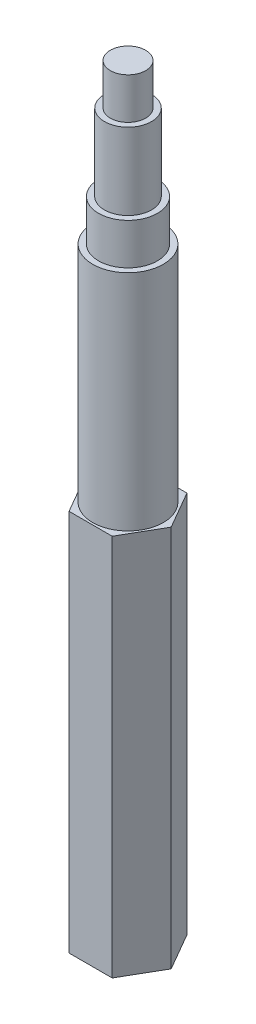
from build123d import *

# Parameters (mm, degrees)
SALIENTE_EXTRUIR1_DEPTH = 130
CROQUIS3_R              = 7.332348419
CROQUIS3_R_2            = 6
CORTAR_EXTRUIR1_DEPTH   = 65
CROQUIS4_R              = 6
CROQUIS4_R_2            = 5
CORTAR_EXTRUIR2_DEPTH   = 27
CROQUIS5_R              = 5
CROQUIS5_R_2            = 4
CORTAR_EXTRUIR3_DEPTH   = 20
CROQUIS6_R              = 4
CROQUIS6_R_2            = 3
CORTAR_EXTRUIR4_DEPTH   = 7


with BuildPart() as part:
    # Croquis2 → Saliente-Extruir1 (new body)
    with BuildSketch(Plane(origin=(0, 0, 0), x_dir=(1, 0, 0), z_dir=(0, 1, 0))):
        Polygon((7.332348419, 0), (3.666174209, 6.35), (-3.666174209, 6.35), (-7.332348419, 0), (-3.666174209, -6.35), (3.666174209, -6.35), align=None)
    extrude(amount=SALIENTE_EXTRUIR1_DEPTH)

    # Croquis3 → Cortar-Extruir1 (cut)
    with BuildSketch(Plane(origin=(0, 130, 0), x_dir=(1, 0, 0), z_dir=(0, 1, 0))):
        Circle(CROQUIS3_R)
        with Locations(Location((0, 0, 0), (0, 0, 270))):
            Circle(CROQUIS3_R_2, mode=Mode.SUBTRACT)
    extrude(amount=-CORTAR_EXTRUIR1_DEPTH, mode=Mode.SUBTRACT)

    # Croquis4 → Cortar-Extruir2 (cut)
    with BuildSketch(Plane(origin=(0, 130, 0), x_dir=(1, 0, 0), z_dir=(0, 1, 0))):
        with Locations(Location((0, 0, 0), (0, 0, 270))):
            Circle(CROQUIS4_R)
        with Locations(Location((0, 0, 0), (0, 0, 270))):
            Circle(CROQUIS4_R_2, mode=Mode.SUBTRACT)
    extrude(amount=-CORTAR_EXTRUIR2_DEPTH, mode=Mode.SUBTRACT)

    # Croquis5 → Cortar-Extruir3 (cut)
    with BuildSketch(Plane(origin=(0, 130, 0), x_dir=(1, 0, 0), z_dir=(0, 1, 0))):
        with Locations(Location((0, 0, 0), (0, 0, 270))):
            Circle(CROQUIS5_R)
        with Locations(Location((0, 0, 0), (0, 0, 270))):
            Circle(CROQUIS5_R_2, mode=Mode.SUBTRACT)
    extrude(amount=-CORTAR_EXTRUIR3_DEPTH, mode=Mode.SUBTRACT)

    # Croquis6 → Cortar-Extruir4 (cut)
    with BuildSketch(Plane(origin=(0, 130, 0), x_dir=(1, 0, 0), z_dir=(0, 1, 0))):
        with Locations(Location((0, 0, 0), (0, 0, 270))):
            Circle(CROQUIS6_R)
        with Locations(Location((0, 0, 0), (0, 0, 270))):
            Circle(CROQUIS6_R_2, mode=Mode.SUBTRACT)
    extrude(amount=-CORTAR_EXTRUIR4_DEPTH, mode=Mode.SUBTRACT)


solid = part.part
